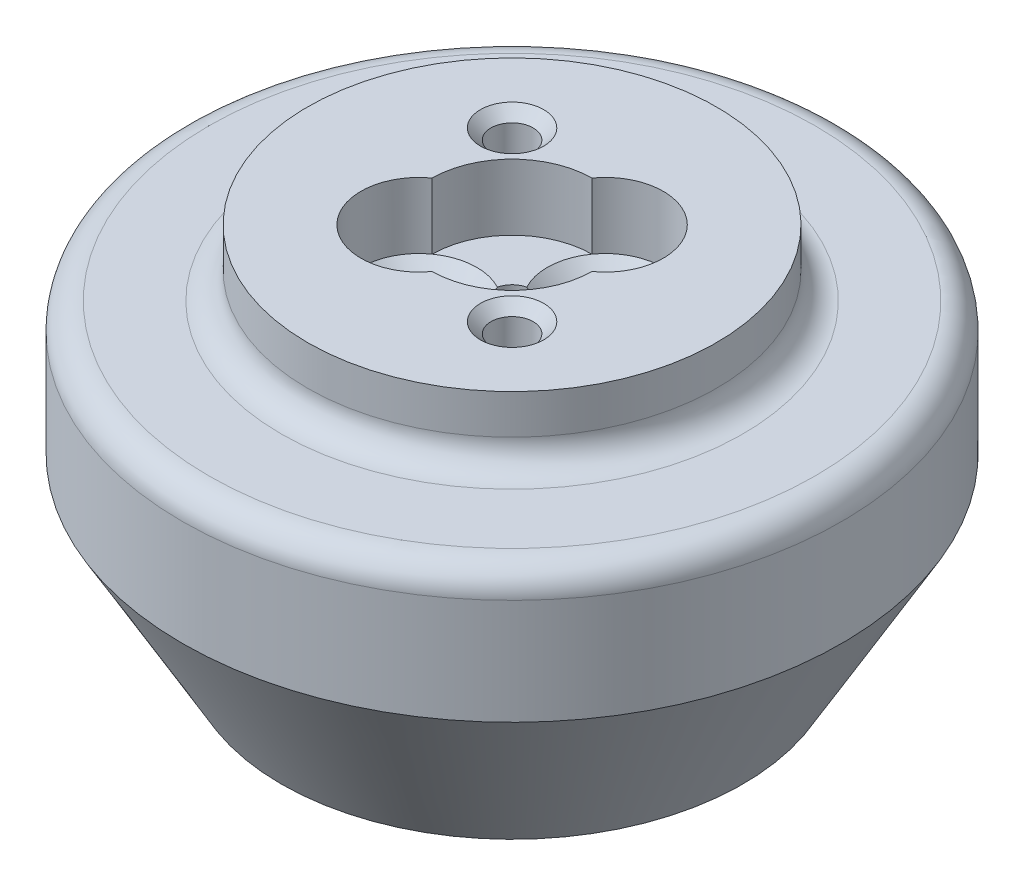
from build123d import *

# Parameters (mm, degrees)
SKETCH1_R                                      = 12.5
SKETCH1_R_2                                    = 7.14375
BOSS_EXTRUDE1_DEPTH                            = 10
SKETCH2_R                                      = 12.5
BOSS_EXTRUDE2_DEPTH                            = 1.5
CHAMFER1_SIZE                                  = 3.75
CHAMFER1_SIZE2                                 = 6.495190528
SKETCH8_R                                      = 7.75
SKETCH8_R_2                                    = 3.05
BOSS_EXTRUDE3_DEPTH                            = 2.5
CSK_FOR_M2_FLAT_HEAD_MACHINE_SCREW1_AT_2_COUNT = 2
CSK_FOR_M2_FLAT_HEAD_MACHINE_SCREW1_AT_2_PITCH = 5
SKETCH16_R                                     = 0.75
CUT_EXTRUDE1_DEPTH                             = 22.089096709
M2X0_4_TAPPED_HOLE1_D                          = 1.6
M2X0_4_TAPPED_HOLE1_CSINK_D                    = 2.4
M2X0_4_TAPPED_HOLE1_CSINK_ANGLE                = 90
CUT_EXTRUDE2_DEPTH                             = 2.5
FILLET1_R                                      = 1


with BuildPart() as part:
    # Sketch1 → Boss-Extrude1 (new body)
    with BuildSketch(Plane(origin=(0, 0, 0), x_dir=(1, 0, 0), z_dir=(0, 1, 0))):
        with Locations(Location((0, 0, 0), (0, 0, 270))):
            Circle(SKETCH1_R)
        with Locations(Location((0, 0, 0), (0, 0, 270))):
            Circle(SKETCH1_R_2, mode=Mode.SUBTRACT)
    extrude(amount=BOSS_EXTRUDE1_DEPTH)

    # Sketch2 → Boss-Extrude2 (add)
    with BuildSketch(Plane(origin=(0, 10, 0), x_dir=(1, 0, 0), z_dir=(0, 1, 0))):
        with Locations(Location((0, 0, 0), (0, 0, 270))):
            Circle(SKETCH2_R)
    extrude(amount=BOSS_EXTRUDE2_DEPTH)

    # Chamfer1
    chamfer1_edges = [part.edges().sort_by_distance(p)[0] for p in [
        (0, 0, -12.5),
    ]]
    chamfer1_side = [part.faces().sort_by_distance(p)[0] for p in [
        (0, 0, -12.146446609),
    ]]
    chamfer(chamfer1_edges, length=CHAMFER1_SIZE, length2=CHAMFER1_SIZE2, reference=chamfer1_side[0])

    # Sketch8 → Boss-Extrude3 (add)
    with BuildSketch(Plane(origin=(0, 11.5, 0), x_dir=(1, 0, 0), z_dir=(0, 1, 0))):
        with Locations(Location((0, 0, 0), (0, 0, 270))):
            Circle(SKETCH8_R)
        with Locations(Location((0, 0, 0), (0, 0, 270))):
            Circle(SKETCH8_R_2, mode=Mode.SUBTRACT)
    extrude(amount=BOSS_EXTRUDE3_DEPTH)

    # Sketch11 → CSK for M2 Flat Head Machine Screw1 (revolve, cut)
    with BuildSketch(Plane(origin=(-1.767766953, 11.5, 1.767766953), x_dir=(0, 0, 1), z_dir=(1, 0, 0))):
        Polygon((0, 0), (0, 11.5), (1.2, 11.5), (1.2, 1), (2.2, 0), align=None)
    csk_for_m2_flat_head_machine_screw1 = revolve(axis=Axis((-1.767766953, 17.85, 1.767766953), (0, -1, 0)), mode=Mode.SUBTRACT)

    # CSK for M2 Flat Head Machine Screw1 at 2: CSK for M2 Flat Head Machine Screw1 ×2
    with Locations(*[Vector(0.707106781186547, 0, -0.707106781186548) * (i * CSK_FOR_M2_FLAT_HEAD_MACHINE_SCREW1_AT_2_PITCH) for i in range(1, CSK_FOR_M2_FLAT_HEAD_MACHINE_SCREW1_AT_2_COUNT)]):
        add(csk_for_m2_flat_head_machine_screw1, mode=Mode.SUBTRACT)

    # Sketch16 → Cut-Extrude1 (cut, through all)
    with BuildSketch(Plane(origin=(0, 11.5, 0), x_dir=(1, 0, 0), z_dir=(0, 1, 0))):
        with Locations(Location((0, 0, 0), (0, 0, 270))):
            Circle(SKETCH16_R)
    extrude(amount=-CUT_EXTRUDE1_DEPTH, mode=Mode.SUBTRACT)

    # M2x0.4 Tapped Hole1 (through all)
    with Locations(Plane(origin=(3.181980515, 14, 3.181980515), x_dir=(0, 0, 1), z_dir=(0, 1, 0))):
        with Locations((0, 0), (-6.36396103, -6.36396103)):
            CounterSinkHole(M2X0_4_TAPPED_HOLE1_D / 2, M2X0_4_TAPPED_HOLE1_CSINK_D / 2, counter_sink_angle=M2X0_4_TAPPED_HOLE1_CSINK_ANGLE)

    # Sketch20 → Cut-Extrude2 (cut)
    with BuildSketch(Plane(origin=(0, 14, 0), x_dir=(1, 0, 0), z_dir=(0, 1, 0))):
        with BuildLine():
            ThreePointArc((0.019981986, -3.049934544), (0.42751991, -1.911696068), (0.172083929, -0.729991179))
            ThreePointArc((0.172083929, -0.729991179), (-0.530330086, -0.530330086), (-0.729991179, 0.172083929))
            ThreePointArc((-0.729991179, 0.172083929), (-1.911696068, 0.42751991), (-3.049934544, 0.019981986))
            ThreePointArc((-3.049934544, 0.019981986), (-3.323401872, -3.323401872), (0.019981986, -3.049934544))
        make_face()
        with BuildLine():
            ThreePointArc((-0.019981986, 3.049934544), (-0.42751991, 1.911696068), (-0.172083929, 0.729991179))
            ThreePointArc((-0.172083929, 0.729991179), (0.530330086, 0.530330086), (0.729991179, -0.172083929))
            ThreePointArc((0.729991179, -0.172083929), (1.911696068, -0.42751991), (3.049934544, -0.019981986))
            ThreePointArc((3.049934544, -0.019981986), (3.323401872, 3.323401872), (-0.019981986, 3.049934544))
        make_face()
    extrude(amount=-CUT_EXTRUDE2_DEPTH, mode=Mode.SUBTRACT)

    # Fillet1
    fillet1_edges = [part.edges().sort_by_distance(p)[0] for p in [
        (0, 11.5, -12.5),
        (0, 11.5, -7.75),
    ]]
    fillet(fillet1_edges, radius=FILLET1_R)


solid = part.part
